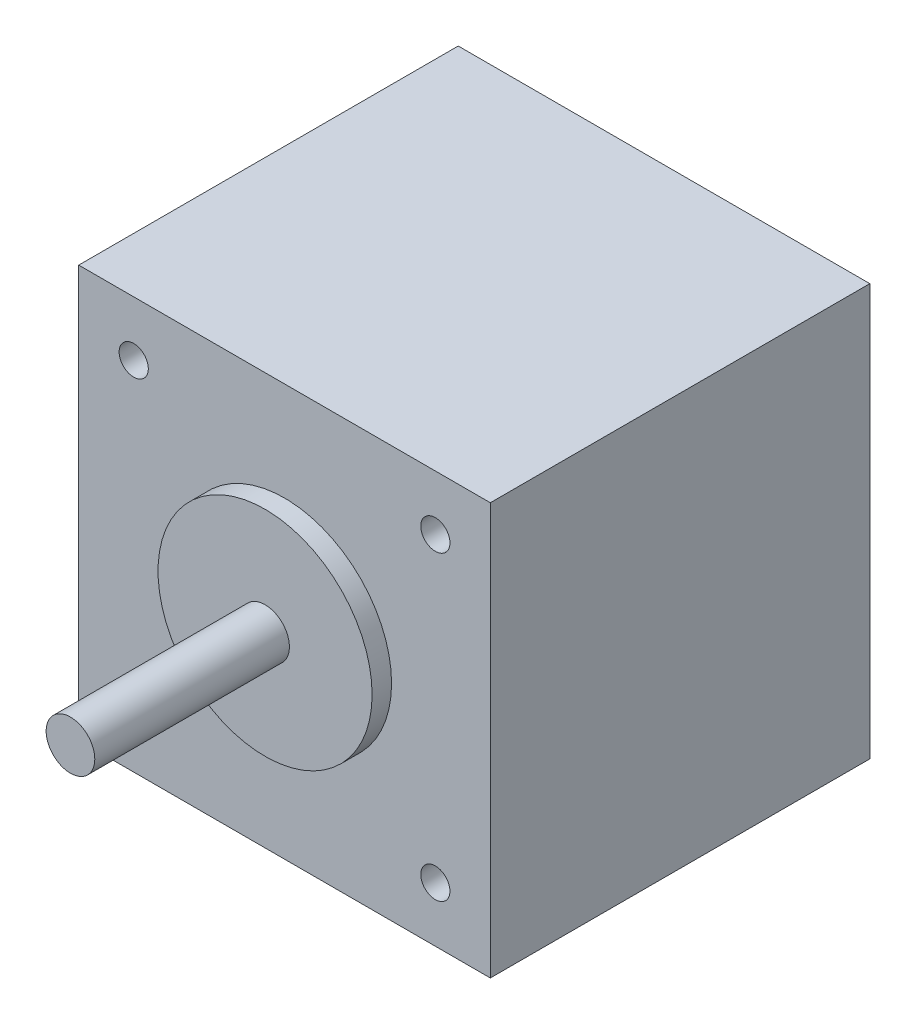
from build123d import *

# Parameters (mm, degrees)
SKIZZE1_W                       = 42.3
SKIZZE1_H                       = 42.3
AUFSATZ_LINEAR_AUSTRAGEN1_DEPTH = 39
SKIZZE2_R                       = 11
AUFSATZ_LINEAR_AUSTRAGEN2_DEPTH = 2
SKIZZE3_R                       = 2.5
AUFSATZ_LINEAR_AUSTRAGEN3_DEPTH = 20
SKIZZE4_R                       = 1.5
SCHNITT_LINEAR_AUSTRAGEN1_DEPTH = 4


with BuildPart() as part:
    # Skizze1 → Aufsatz-Linear austragen1 (new body)
    with BuildSketch(Plane.XY):
        Rectangle(SKIZZE1_W, SKIZZE1_H)
    extrude(amount=AUFSATZ_LINEAR_AUSTRAGEN1_DEPTH)

    # Skizze2 → Aufsatz-Linear austragen2 (add)
    with BuildSketch(Plane.XY.offset(39)):
        Circle(SKIZZE2_R)
    extrude(amount=AUFSATZ_LINEAR_AUSTRAGEN2_DEPTH)

    # Skizze3 → Aufsatz-Linear austragen3 (add)
    with BuildSketch(Plane.XY.offset(41)):
        Circle(SKIZZE3_R)
    extrude(amount=AUFSATZ_LINEAR_AUSTRAGEN3_DEPTH)

    # Skizze4 → Schnitt-Linear austragen1 (cut)
    with BuildSketch(Plane.XY.offset(39)):
        with Locations((-15.5, 15.5)):
            Circle(SKIZZE4_R)
        with Locations((15.5, 15.5)):
            Circle(SKIZZE4_R)
        with Locations((15.5, -15.5)):
            Circle(SKIZZE4_R)
        with Locations((-15.5, -15.5)):
            Circle(SKIZZE4_R)
    extrude(amount=-SCHNITT_LINEAR_AUSTRAGEN1_DEPTH, mode=Mode.SUBTRACT)


solid = part.part
